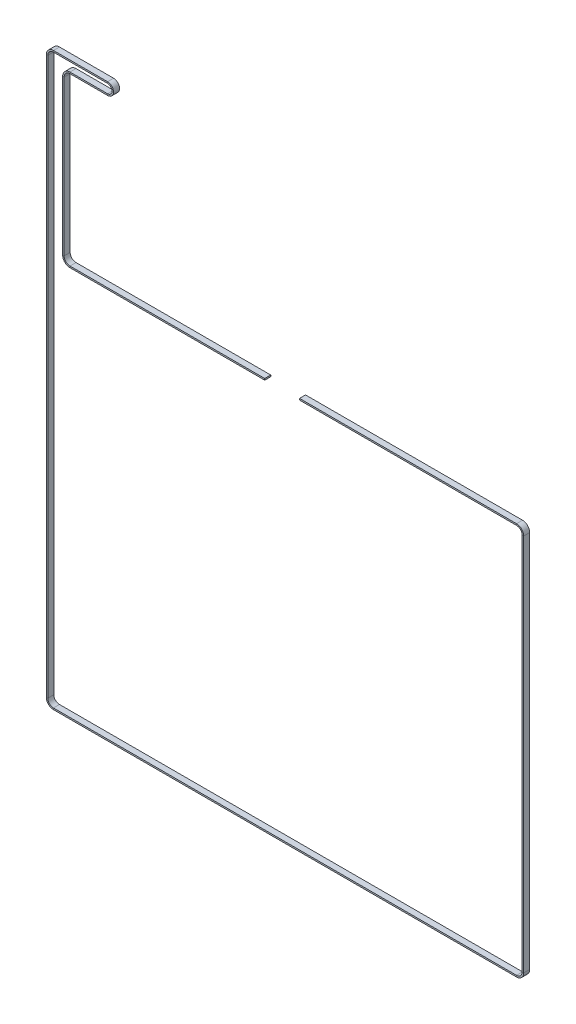
from build123d import *

# Parameters (mm, degrees)
SKETCH2_W = 6
SKETCH2_H = 1.5


with BuildPart() as part:
    # Sweep1: sweep along a path in Sketch1
    with BuildLine(Plane(origin=(0, -21, 4.45), x_dir=(1, 0, 0), z_dir=(0, 0, 1))) as sweep1_path:
        Line((239.00109203, -104.168552817), (455.5, -104.168552817))
        ThreePointArc((455.5, -104.168552817), (460.00780573, -106.035747087), (461.875, -110.543552817))
        Line((461.875, -110.543552817), (461.875, -488))
        ThreePointArc((461.875, -488), (460.00780573, -492.50780573), (455.5, -494.375))
        Line((455.5, -494.375), (-6.5, -494.375))
        ThreePointArc((-6.5, -494.375), (-11.00780573, -492.50780573), (-12.875, -488))
        Line((-12.875, -488), (-12.875, 67.325))
        ThreePointArc((-12.875, 67.325), (-11.00780573, 71.83280573), (-6.5, 73.7))
        Line((-6.5, 73.7), (47.5, 73.7))
        ThreePointArc((47.5, 73.7), (52.7, 68.5), (47.5, 63.3))
        Line((47.5, 63.3), (10, 63.3))
        ThreePointArc((10, 63.3), (5.333095244, 61.366904756), (3.4, 56.7))
        Line((3.4, 56.7), (3.4, -97.718552817))
        ThreePointArc((3.4, -97.718552817), (5.333095244, -102.385457573), (10, -104.318552817))
        Line((10, -104.318552817), (204.30109203, -104.318552817))
    # Sketch2 → Sweep1 (sweep)
    with BuildSketch(Plane(origin=(239.00109203, -125.168552817, 4.45), x_dir=(0, 0, 1), z_dir=(-1, 0, 0))):
        Rectangle(SKETCH2_W, SKETCH2_H)
    sweep(path=sweep1_path.line)


solid = part.part
